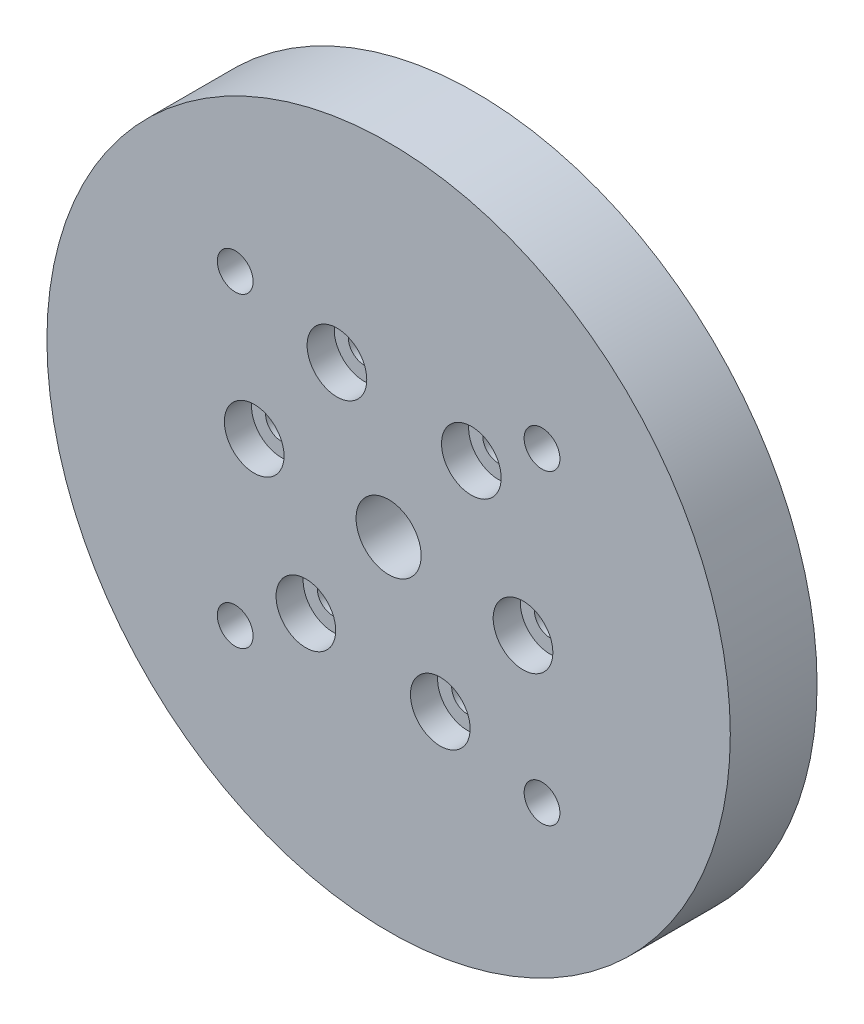
from build123d import *

# Parameters (mm, degrees)
BRIDA_START                  = 567
SK_BRIDA_R                   = 31.5
BRIDA_DEPTH                  = 8
CENTRO_START                 = 567
SK_CENTRO_R                  = 3
CENTRO_DEPTH                 = 8
ROSCAS_M4_HERRAMIENTA_START  = 567
SK_ROSCAS_M4_HERRAMIENTA_R   = 1.65
ROSCAS_M4_HERRAMIENTA_DEPTH  = 8
PASANTES_M2_5_ROTOR_J6_START = 567
SK_PASANTES_M2_5_ROTOR_J6_R  = 1.45
PASANTES_M2_5_ROTOR_J6_DEPTH = 8
CAJAS_M2_5_START             = 572.5
SK_CAJAS_M2_5_R              = 2.75
CAJAS_M2_5_DEPTH             = 2.5


with BuildPart() as part:
    # Sk_Brida → Brida (new body)
    with BuildSketch(Plane.XY.offset(BRIDA_START)):
        Circle(SK_BRIDA_R)
    extrude(amount=BRIDA_DEPTH)

    # Sk_Centro → Centro (cut)
    with BuildSketch(Plane.XY.offset(CENTRO_START)):
        Circle(SK_CENTRO_R)
    extrude(amount=CENTRO_DEPTH, mode=Mode.SUBTRACT)

    # Sk_Roscas_M4_herramienta → Roscas_M4_herramienta (cut)
    with BuildSketch(Plane.XY.offset(ROSCAS_M4_HERRAMIENTA_START)):
        with Locations((14.142135624, 14.142135624)):
            Circle(SK_ROSCAS_M4_HERRAMIENTA_R)
        with Locations((-14.142135624, 14.142135624)):
            Circle(SK_ROSCAS_M4_HERRAMIENTA_R)
        with Locations((-14.142135624, -14.142135624)):
            Circle(SK_ROSCAS_M4_HERRAMIENTA_R)
        with Locations((14.142135624, -14.142135624)):
            Circle(SK_ROSCAS_M4_HERRAMIENTA_R)
    extrude(amount=ROSCAS_M4_HERRAMIENTA_DEPTH, mode=Mode.SUBTRACT)

    # Sk_Pasantes_M2-5_rotor_J6 → Pasantes_M2-5_rotor_J6 (cut)
    with BuildSketch(Plane.XY.offset(PASANTES_M2_5_ROTOR_J6_START)):
        with Locations((12.390194253, -1.653204878)):
            Circle(SK_PASANTES_M2_5_ROTOR_J6_R)
        with Locations((7.626814549, 9.903620542)):
            Circle(SK_PASANTES_M2_5_ROTOR_J6_R)
        with Locations((-4.763379704, 11.55682542)):
            Circle(SK_PASANTES_M2_5_ROTOR_J6_R)
        with Locations((-12.390194253, 1.653204878)):
            Circle(SK_PASANTES_M2_5_ROTOR_J6_R)
        with Locations((-7.626814549, -9.903620542)):
            Circle(SK_PASANTES_M2_5_ROTOR_J6_R)
        with Locations((4.763379704, -11.55682542)):
            Circle(SK_PASANTES_M2_5_ROTOR_J6_R)
    extrude(amount=PASANTES_M2_5_ROTOR_J6_DEPTH, mode=Mode.SUBTRACT)

    # Sk_Cajas_M2-5 → Cajas_M2-5 (cut)
    with BuildSketch(Plane.XY.offset(CAJAS_M2_5_START)):
        with Locations((12.390194253, -1.653204878)):
            Circle(SK_CAJAS_M2_5_R)
        with Locations((7.626814549, 9.903620542)):
            Circle(SK_CAJAS_M2_5_R)
        with Locations((-4.763379704, 11.55682542)):
            Circle(SK_CAJAS_M2_5_R)
        with Locations((-12.390194253, 1.653204878)):
            Circle(SK_CAJAS_M2_5_R)
        with Locations((-7.626814549, -9.903620542)):
            Circle(SK_CAJAS_M2_5_R)
        with Locations((4.763379704, -11.55682542)):
            Circle(SK_CAJAS_M2_5_R)
    extrude(amount=CAJAS_M2_5_DEPTH, mode=Mode.SUBTRACT)


solid = part.part
